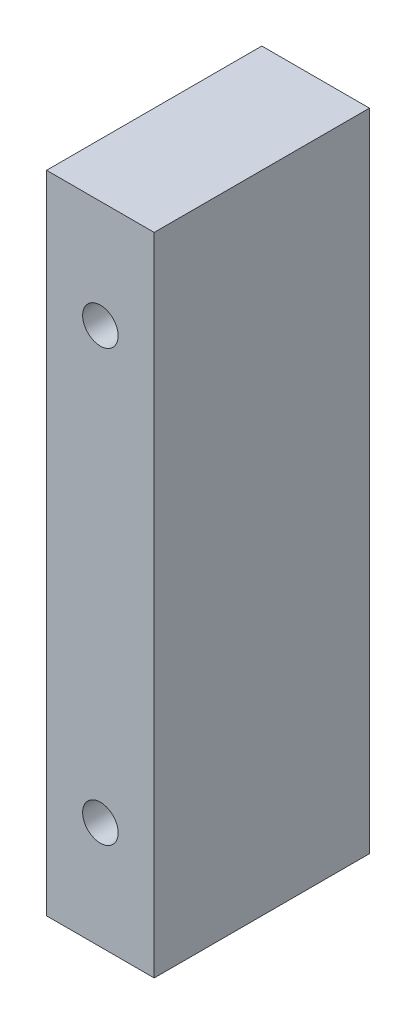
from build123d import *

# Parameters (mm, degrees)
SKETCH_1_W                = 20
SKETCH_1_H                = 120
SKETCH_1_R                = 3.3
FIXED_JAW_20X120X40_DEPTH = 40


with BuildPart() as part:
    # 草图1 → Fixed_jaw_20x120x40 (new body)
    with BuildSketch(Plane.XY):
        with Locations((10, 60)):
            Rectangle(SKETCH_1_W, SKETCH_1_H)
        with Locations((10, 20)):
            Circle(SKETCH_1_R, mode=Mode.SUBTRACT)
        with Locations((10, 100)):
            Circle(SKETCH_1_R, mode=Mode.SUBTRACT)
    extrude(amount=FIXED_JAW_20X120X40_DEPTH)


solid = part.part
